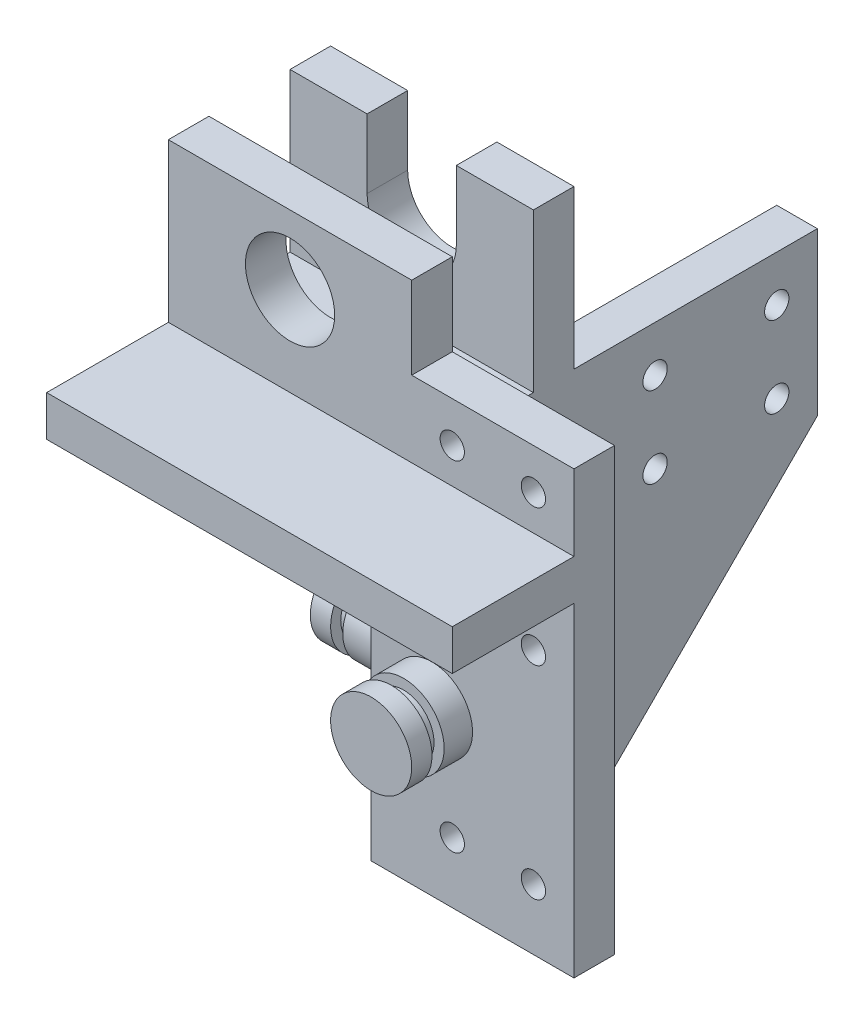
from build123d import *

# Parameters (mm, degrees)
BOSS_EXTRUDE1_DEPTH = 10
BOSS_EXTRUDE2_DEPTH = 80
SKETCH3_W           = 40
SKETCH3_H           = 10
BOSS_EXTRUDE3_DEPTH = 18.71
SKETCH4_W           = 10
SKETCH4_H           = 90
BOSS_EXTRUDE4_DEPTH = 50
CUT_EXTRUDE1_REACH  = 162.624
SKETCH6_R           = 3.5
CUT_EXTRUDE2_DEPTH  = 10
CUT_EXTRUDE3_DEPTH  = 10
SKETCH8_R           = 3
CUT_EXTRUDE4_DEPTH  = 10
SKETCH9_R           = 3
CUT_EXTRUDE5_DEPTH  = 10
SKETCH10_W          = 60
SKETCH10_H          = 10
BOSS_EXTRUDE5_DEPTH = 39
SKETCH11_R          = 11
CUT_EXTRUDE6_DEPTH  = 10
CUT_EXTRUDE7_START  = -10
CUT_EXTRUDE7_DEPTH  = 10
SKETCH13_R          = 10
BOSS_EXTRUDE6_DEPTH = 15
CUT_EXTRUDE8_START  = -8
SKETCH14_R          = 10
SKETCH14_R_2        = 7.5
CUT_EXTRUDE8_DEPTH  = 3
SKETCH15_R          = 10
BOSS_EXTRUDE7_DEPTH = 20
CUT_EXTRUDE9_START  = -8
SKETCH16_R          = 10
SKETCH16_R_2        = 7.5
CUT_EXTRUDE9_DEPTH  = 3


with BuildPart() as part:
    # Sketch1 → Boss-Extrude1 (new body)
    with BuildSketch(Plane(origin=(0, 0, 0), x_dir=(1, 0, 0), z_dir=(0, 1, 0))):
        Polygon((0, 0), (100, 0), (100, 40), (60, 40), (60, 80), (0, 80), align=None)
    extrude(amount=BOSS_EXTRUDE1_DEPTH)

    # Sketch2 → Boss-Extrude2 (add)
    with BuildSketch(Plane.XZ):
        Polygon((60, -40), (100, -40), (100, -30), (50, -30), (50, -80), (60, -80), align=None)
    extrude(amount=BOSS_EXTRUDE2_DEPTH)

    # Sketch3 → Boss-Extrude3 (add)
    with BuildSketch(Plane(origin=(0, 10, 0), x_dir=(1, 0, 0), z_dir=(0, 1, 0))):
        with Locations((80, 35)):
            Rectangle(SKETCH3_W, SKETCH3_H)
    extrude(amount=BOSS_EXTRUDE3_DEPTH)

    # Sketch4 → Boss-Extrude4 (add)
    with BuildSketch(Plane(origin=(0, 0, -80), x_dir=(-1, 0, 0), z_dir=(0, 0, -1))):
        with Locations((-55, -35)):
            Rectangle(SKETCH4_W, SKETCH4_H)
    extrude(amount=BOSS_EXTRUDE4_DEPTH)

    # Sketch5 → Cut-Extrude1 (cut, up to next)
    with BuildSketch(Plane.ZY.offset(-50), mode=Mode.PRIVATE) as cut_extrude1_sk1:
        Polygon((-80, -80), (-130, -30), (-130, -80), align=None)
    cut_extrude1_tool1 = extrude(cut_extrude1_sk1.sketch, amount=-CUT_EXTRUDE1_REACH, mode=Mode.PRIVATE) & part.part
    add(cut_extrude1_tool1.solids().sort_by_distance((50, -63.333333, -113.333333))[0], mode=Mode.SUBTRACT)

    # Sketch6 → Cut-Extrude2 (cut)
    with BuildSketch(Plane(origin=(0, 10, 0), x_dir=(1, 0, 0), z_dir=(0, 1, 0))):
        with Locations(Location((7, 50, 0), (0, 0, 270))):
            Circle(SKETCH6_R)
        with Locations(Location((53, 50, 0), (0, 0, 270))):
            Circle(SKETCH6_R)
    extrude(amount=-CUT_EXTRUDE2_DEPTH, mode=Mode.SUBTRACT)

    # Sketch7 → Cut-Extrude3 (cut)
    with BuildSketch(Plane.ZY.offset(-50)):
        Polygon((-50, 0), (-43, 0), (-43, -6), (-57, -6), (-57, 0), align=None)
    extrude(amount=-CUT_EXTRUDE3_DEPTH, mode=Mode.SUBTRACT)

    # Sketch8 → Cut-Extrude4 (cut)
    with BuildSketch(Plane.XY.offset(-30)):
        with Locations((70, 18.71)):
            Circle(SKETCH8_R)
        with Locations((90, 18.71)):
            Circle(SKETCH8_R)
        with Locations((70, -15)):
            Circle(SKETCH8_R)
        with Locations((90, -15)):
            Circle(SKETCH8_R)
        with Locations((90, -65)):
            Circle(SKETCH8_R)
        with Locations((70, -65)):
            Circle(SKETCH8_R)
    extrude(amount=-CUT_EXTRUDE4_DEPTH, mode=Mode.SUBTRACT)

    # Sketch9 → Cut-Extrude5 (cut)
    with BuildSketch(Plane.ZY.offset(-50)):
        with Locations((-50, -15)):
            Circle(SKETCH9_R)
        with Locations((-70, -15)):
            Circle(SKETCH9_R)
        with Locations((-70, -65)):
            Circle(SKETCH9_R)
        with Locations((-50, -65)):
            Circle(SKETCH9_R)
        with Locations((-90, -1.3)):
            Circle(SKETCH9_R)
        with Locations((-120, -1.3)):
            Circle(SKETCH9_R)
        with Locations((-90, -21.3)):
            Circle(SKETCH9_R)
        with Locations((-120, -21.3)):
            Circle(SKETCH9_R)
    extrude(amount=-CUT_EXTRUDE5_DEPTH, mode=Mode.SUBTRACT)

    # Sketch10 → Boss-Extrude5 (add)
    with BuildSketch(Plane(origin=(0, 10, 0), x_dir=(1, 0, 0), z_dir=(0, 1, 0))):
        with Locations((30, 35)):
            Rectangle(SKETCH10_W, SKETCH10_H)
        with Locations((30, 65)):
            Rectangle(SKETCH10_W, SKETCH10_H)
    extrude(amount=BOSS_EXTRUDE5_DEPTH)

    # Sketch11 → Cut-Extrude6 (cut)
    with BuildSketch(Plane.XY.offset(-30)):
        with Locations((30, 32)):
            Circle(SKETCH11_R)
    extrude(amount=-CUT_EXTRUDE6_DEPTH, mode=Mode.SUBTRACT)

    # Sketch12 → Cut-Extrude7 (cut)
    with BuildSketch(Plane(origin=(0, 0, -70), x_dir=(-1, 0, 0), z_dir=(0, 0, -1)).offset(CUT_EXTRUDE7_START)):
        with BuildLine():
            Line((-19, 49), (-19, 32))
            ThreePointArc((-19, 32), (-30, 21), (-41, 32))
            Line((-41, 32), (-41, 49))
            Line((-41, 49), (-19, 49))
        make_face()
    extrude(amount=CUT_EXTRUDE7_DEPTH, mode=Mode.SUBTRACT)

    # Sketch13 → Boss-Extrude6 (add)
    with BuildSketch(Plane.XY.offset(-30)):
        with Locations(Location((65, -40, 0), (0, 0, 180))):
            Circle(SKETCH13_R)
    extrude(amount=BOSS_EXTRUDE6_DEPTH)

    # Sketch14 → Cut-Extrude8 (cut)
    with BuildSketch(Plane.XY.offset(-15).offset(CUT_EXTRUDE8_START)):
        with Locations(Location((65, -40, 0), (0, 0, 180))):
            Circle(SKETCH14_R)
        with Locations((65, -40)):
            Circle(SKETCH14_R_2, mode=Mode.SUBTRACT)
    extrude(amount=CUT_EXTRUDE8_DEPTH, mode=Mode.SUBTRACT)

    # Sketch15 → Boss-Extrude7 (add)
    with BuildSketch(Plane.ZY.offset(-50)):
        with Locations(Location((-45, -40, 0), (0, 0, 180))):
            Circle(SKETCH15_R)
    extrude(amount=BOSS_EXTRUDE7_DEPTH)

    # Sketch16 → Cut-Extrude9 (cut)
    with BuildSketch(Plane.ZY.offset(-30).offset(CUT_EXTRUDE9_START)):
        with Locations(Location((-45, -40, 0), (0, 0, 180))):
            Circle(SKETCH16_R)
        with Locations((-45, -40)):
            Circle(SKETCH16_R_2, mode=Mode.SUBTRACT)
    extrude(amount=CUT_EXTRUDE9_DEPTH, mode=Mode.SUBTRACT)


solid = part.part
